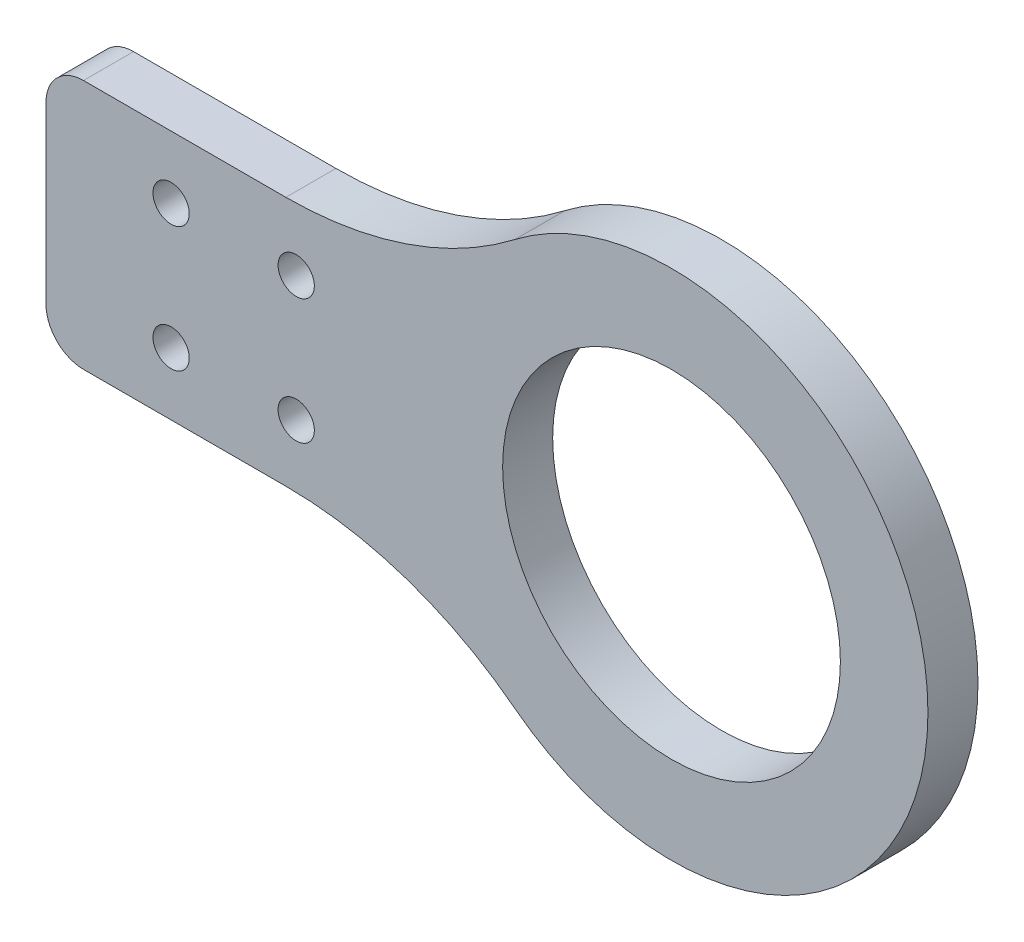
from build123d import *

# Parameters (mm, degrees)
SKETCH_1_R          = 13.5
EXTRUDE_1_DEPTH     = 4
SKETCH_2_R          = 1.45
CUT_EXTRUDE_1_DEPTH = 50.198239165
FILLET_1_R          = 30
FILLET_2_R          = 3


with BuildPart() as part:
    # 草图1 → 凸台-拉伸1 (new body)
    with BuildSketch(Plane.XY):
        with BuildLine():
            Line((0, 0), (-32.104469832, 0))
            Line((-32.104469832, 0), (-32.104469832, -20))
            Line((-32.104469832, -20), (0, -20))
            ThreePointArc((0, -20), (38.395530168, -10), (0, 0))
        make_face()
        with Locations((17.895530168, -10)):
            Circle(SKETCH_1_R, mode=Mode.SUBTRACT)
    extrude(amount=EXTRUDE_1_DEPTH)

    # 草图2 → 切除-拉伸1 (cut, through all)
    with BuildSketch(Plane.XY.offset(4)):
        with Locations((-22.104469832, -5)):
            Circle(SKETCH_2_R)
        with Locations((-12.104469832, -5)):
            Circle(SKETCH_2_R)
        with Locations((-12.104469832, -15)):
            Circle(SKETCH_2_R)
        with Locations((-22.104469832, -15)):
            Circle(SKETCH_2_R)
    extrude(amount=-CUT_EXTRUDE_1_DEPTH, mode=Mode.SUBTRACT)

    # 圆角1
    fillet_1_edges = [part.edges().sort_by_distance(p)[0] for p in [
        (0, -20, 2),
        (0, 0, 2),
    ]]
    fillet(fillet_1_edges, radius=FILLET_1_R)

    # 圆角2
    fillet_2_edges = [part.edges().sort_by_distance(p)[0] for p in [
        (-32.104469832, -20, 2),
        (-32.104469832, 0, 2),
    ]]
    fillet(fillet_2_edges, radius=FILLET_2_R)


solid = part.part
